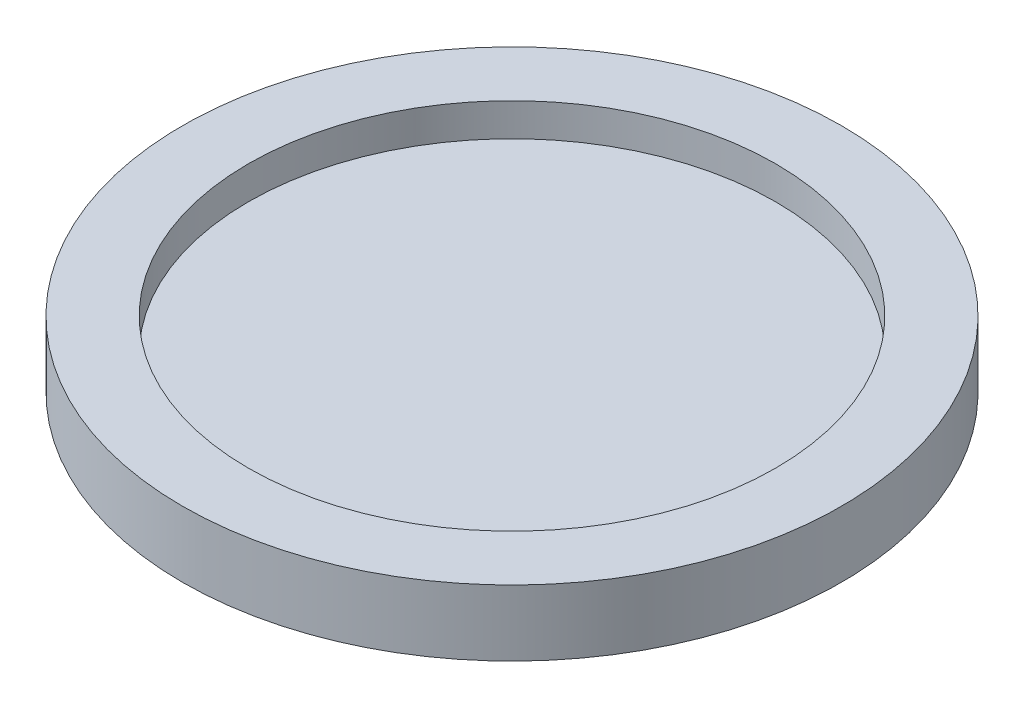
from build123d import *

# Parameters (mm, degrees)
SKETCH1_R           = 5
SKETCH1_R_2         = 4
BOSS_EXTRUDE1_DEPTH = 1
SKETCH1_2_R         = 4
BOSS_EXTRUDE2_DEPTH = 0.5


with BuildPart() as part:
    # Sketch1 → Boss-Extrude1 (new body)
    with BuildSketch(Plane(origin=(0, 0, 0), x_dir=(1, 0, 0), z_dir=(0, 1, 0))):
        Circle(SKETCH1_R)
        Circle(SKETCH1_R_2, mode=Mode.SUBTRACT)
    extrude(amount=BOSS_EXTRUDE1_DEPTH)

    # Sketch1<2> → Boss-Extrude2 (add)
    with BuildSketch(Plane(origin=(0, 0, 0), x_dir=(1, 0, 0), z_dir=(0, 1, 0))):
        Circle(SKETCH1_2_R)
    extrude(amount=BOSS_EXTRUDE2_DEPTH)


solid = part.part
